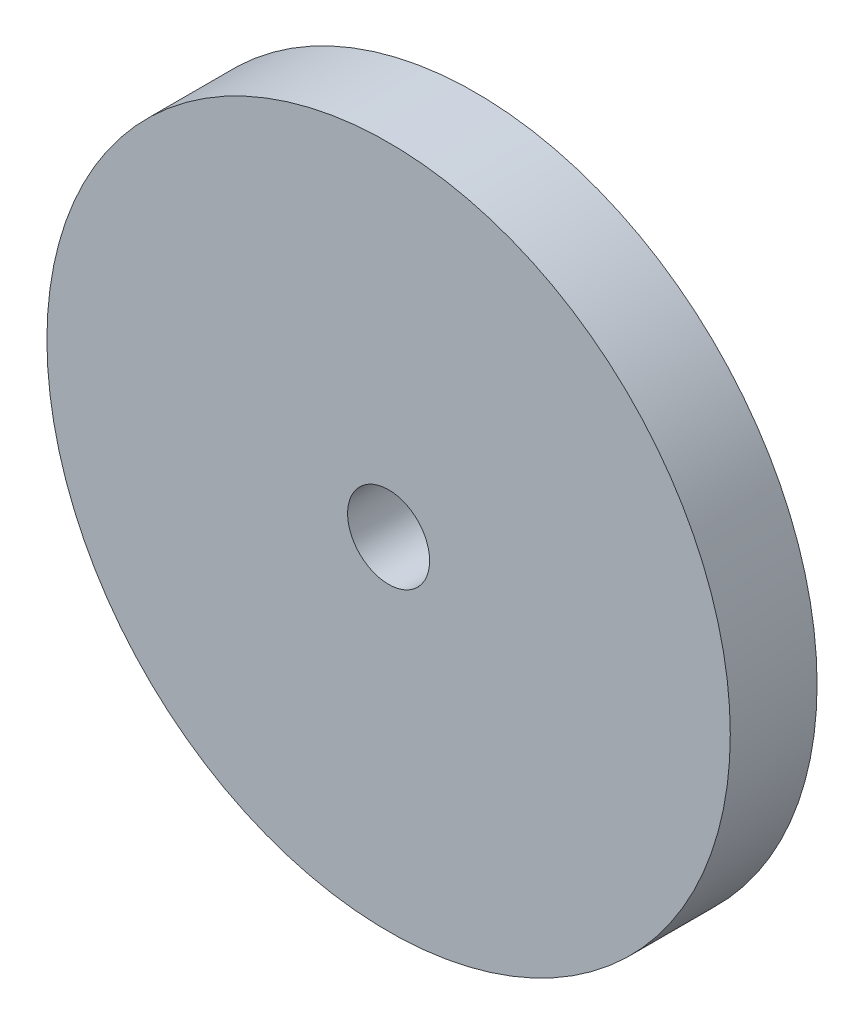
from build123d import *

# Parameters (mm, degrees)
SKETCH1_R           = 25
SKETCH1_R_2         = 3
BOSS_EXTRUDE1_DEPTH = 6.35


with BuildPart() as part:
    # Sketch1 → Boss-Extrude1 (new body)
    with BuildSketch(Plane.XY):
        Circle(SKETCH1_R)
        Circle(SKETCH1_R_2, mode=Mode.SUBTRACT)
    extrude(amount=BOSS_EXTRUDE1_DEPTH)


solid = part.part
